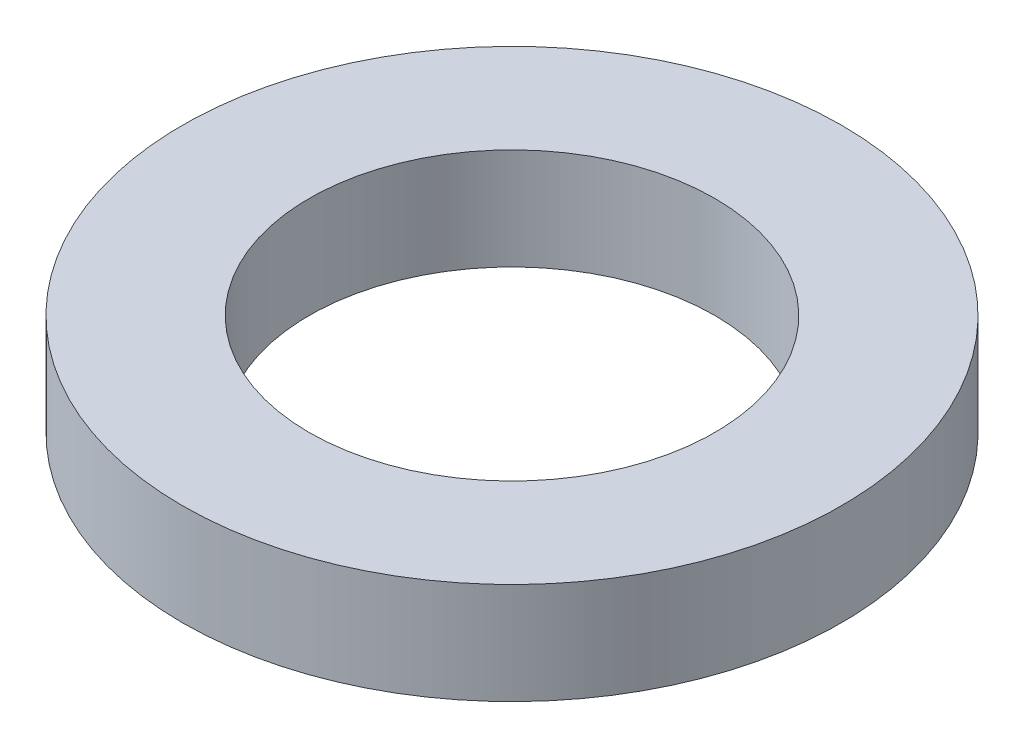
from build123d import *

# Parameters (mm, degrees)
SKETCH1_R           = 6.5
SKETCH1_R_2         = 4
BOSS_EXTRUDE1_DEPTH = 2


with BuildPart() as part:
    # Sketch1 → Boss-Extrude1 (new body)
    with BuildSketch(Plane(origin=(0, 0, 0), x_dir=(1, 0, 0), z_dir=(0, 1, 0))):
        with Locations(Location((0, 0, 0), (0, 0, 270))):
            Circle(SKETCH1_R)
        with Locations(Location((0, 0, 0), (0, 0, 270))):
            Circle(SKETCH1_R_2, mode=Mode.SUBTRACT)
    extrude(amount=BOSS_EXTRUDE1_DEPTH)


solid = part.part
